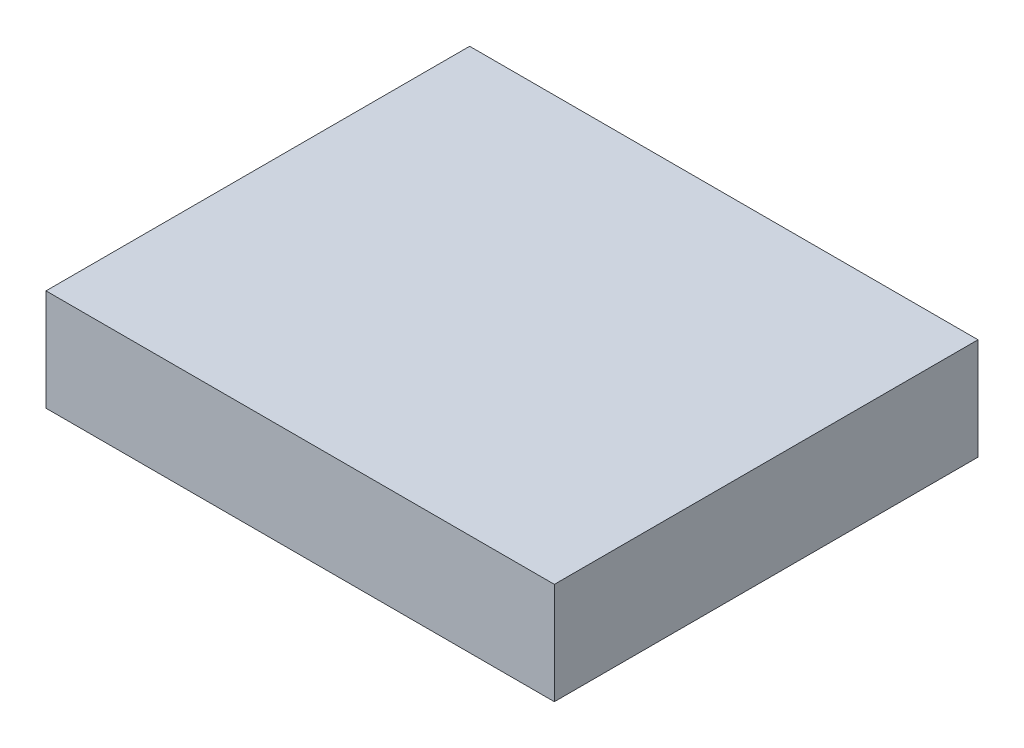
from build123d import *

# Parameters (mm, degrees)
PRESS_UC_CATAL_FLANS_ISO9409_1_START = -550
SKETCH1_W                            = 60
SKETCH1_H                            = 12
PRESS_UC_CATAL_FLANS_ISO9409_1_DEPTH = 50


with BuildPart() as part:
    # Sketch1 → PRESS_uc_catal_flans_ISO9409_1 (new body)
    with BuildSketch(Plane.XY.offset(PRESS_UC_CATAL_FLANS_ISO9409_1_START)):
        with Locations((350, 1260)):
            Rectangle(SKETCH1_W, SKETCH1_H)
    extrude(amount=-PRESS_UC_CATAL_FLANS_ISO9409_1_DEPTH)


solid = part.part
